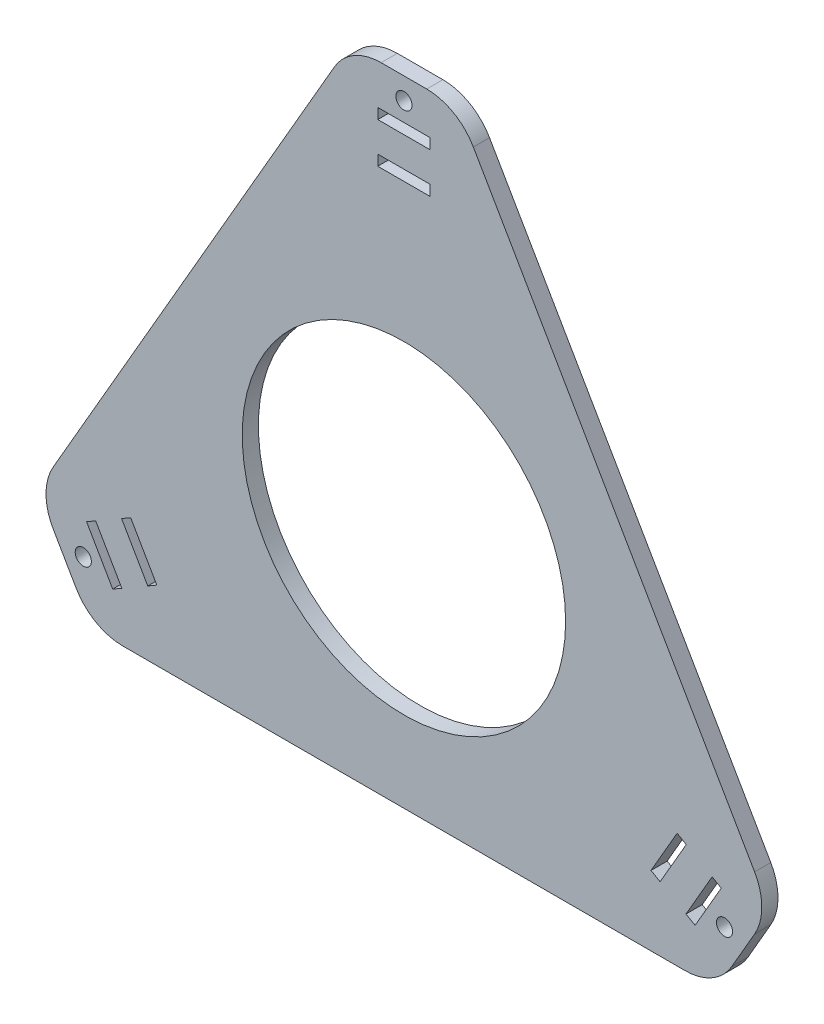
from build123d import *

# Parameters (mm, degrees)
SKETCH_1_R      = 1.5
SKETCH_1_R_2    = 30
SKETCH_1_W      = 9.7
SKETCH_1_H      = 1.95
EXTRUDE_1_DEPTH = 3


with BuildPart() as part:
    # Эскиз1 → Бобышка-Вытянуть1 (new body)
    with BuildSketch(Plane.XY):
        with BuildLine():
            Line((-52.168783649, -45), (52.168783649, -45))
            ThreePointArc((52.168783649, -45), (57.168783649, -43.660254038), (60.829037687, -40))
            Line((60.829037687, -40), (65.055534995, -32.679491924))
            ThreePointArc((65.055534995, -32.679491924), (66.395280957, -27.679491924), (65.055534995, -22.679491924))
            Line((65.055534995, -22.679491924), (12.886751346, 67.679491924))
            ThreePointArc((12.886751346, 67.679491924), (9.226497308, 71.339745962), (4.226497308, 72.679491924))
            Line((4.226497308, 72.679491924), (-4.226497308, 72.679491924))
            ThreePointArc((-4.226497308, 72.679491924), (-9.226497308, 71.339745962), (-12.886751346, 67.679491924))
            Line((-12.886751346, 67.679491924), (-65.055534995, -22.679491924))
            ThreePointArc((-65.055534995, -22.679491924), (-66.395280957, -27.679491924), (-65.055534995, -32.679491924))
            Line((-65.055534995, -32.679491924), (-60.829037687, -40))
            ThreePointArc((-60.829037687, -40), (-57.168783649, -43.660254038), (-52.168783649, -45))
        make_face()
        with Locations((-59.478184725, -34.339745962)):
            Circle(SKETCH_1_R, mode=Mode.SUBTRACT)
        with Locations(Location((0, 68.679491924, 0), (0, 0, 180))):
            Circle(SKETCH_1_R, mode=Mode.SUBTRACT)
        with Locations((59.478184725, -34.339745962)):
            Circle(SKETCH_1_R, mode=Mode.SUBTRACT)
        Circle(SKETCH_1_R_2, mode=Mode.SUBTRACT)
        Polygon((-54.022095812, -36.789969171), (-58.872095812, -28.389522754), (-57.183346275, -27.414522754), (-52.333346275, -35.814969171), align=None, mode=Mode.SUBTRACT)
        with Locations((0, 64.204491924)):
            Rectangle(SKETCH_1_W, SKETCH_1_H, mode=Mode.SUBTRACT)
        Polygon((58.872095812, -28.389522754), (54.022095812, -36.789969171), (52.333346275, -35.814969171), (57.183346275, -27.414522754), align=None, mode=Mode.SUBTRACT)
        Polygon((-47.526905284, -33.039969171), (-52.376905284, -24.639522754), (-50.688155746, -23.664522754), (-45.838155746, -32.064969171), align=None, mode=Mode.SUBTRACT)
        with Locations((0, 56.704491924)):
            Rectangle(SKETCH_1_W, SKETCH_1_H, mode=Mode.SUBTRACT)
        Polygon((52.376905284, -24.639522754), (47.526905284, -33.039969171), (45.838155746, -32.064969171), (50.688155746, -23.664522754), align=None, mode=Mode.SUBTRACT)
    extrude(amount=EXTRUDE_1_DEPTH)


solid = part.part
